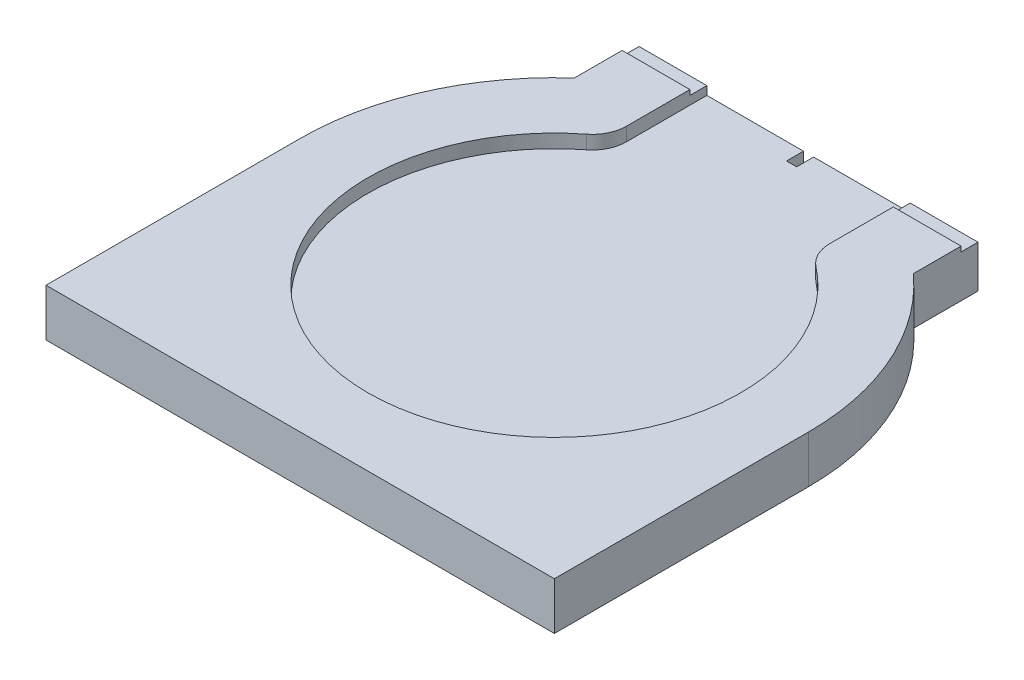
from build123d import *

# Parameters (mm, degrees)
BOSS_EXTRUDE1_DEPTH = 0.8
BOSS_EXTRUDE2_DEPTH = 1
BOSS_EXTRUDE3_START = 1
BOSS_EXTRUDE3_DEPTH = 1
CUT_EXTRUDE1_DEPTH  = 0.5
SKETCH5_W           = 22.271873455
SKETCH5_H           = 20.1975323
CUT_EXTRUDE2_DEPTH  = 3


with BuildPart() as part:
    # Sketch1 → Boss-Extrude1 (new body)
    with BuildSketch(Plane(origin=(0, 0, 0), x_dir=(1, 0, 0), z_dir=(0, 1, 0))):
        with BuildLine():
            Line((-5, 7.5), (-5, 5.590169944))
            ThreePointArc((-5, 5.590169944), (-6.846531969, 3.061862178), (-7.5, 0))
            Line((-7.5, 0), (-7.5, -7.5))
            Line((-7.5, -7.5), (7.5, -7.5))
            Line((7.5, -7.5), (7.5, 0))
            ThreePointArc((7.5, 0), (6.846531969, 3.061862178), (5, 5.590169944))
            Line((5, 5.590169944), (5, 7.5))
            Line((5, 7.5), (3, 7.5))
            Line((3, 7.5), (3, 5.5))
            Line((3, 5.5), (3, 5.123475383))
            ThreePointArc((3, 5.123475383), (3.101282966, 4.684946373), (3.384615385, 4.335248401))
            ThreePointArc((3.384615385, 4.335248401), (0, -5.5), (-3.384615385, 4.335248401))
            ThreePointArc((-3.384615385, 4.335248401), (-3.101282966, 4.684946373), (-3, 5.123475383))
            Line((-3, 5.123475383), (-3, 5.5))
            Line((-3, 5.5), (-3, 7.5))
            Line((-3, 7.5), (-5, 7.5))
        make_face()
    extrude(amount=BOSS_EXTRUDE1_DEPTH)

    # Sketch2 → Boss-Extrude2 (add)
    with BuildSketch(Plane(origin=(0, 0.8, 0), x_dir=(1, 0, 0), z_dir=(0, 1, 0))):
        with BuildLine():
            Line((5, 5.590169944), (5, 7.5))
            Line((5, 7.5), (3, 7.5))
            Line((3, 7.5), (-3, 7.5))
            Line((-3, 7.5), (-5, 7.5))
            Line((-5, 7.5), (-5, 5.590169944))
            ThreePointArc((-5, 5.590169944), (-6.846531969, 3.061862178), (-7.5, 0))
            Line((-7.5, 0), (-7.5, -7.5))
            Line((-7.5, -7.5), (7.5, -7.5))
            Line((7.5, -7.5), (7.5, 0))
            ThreePointArc((7.5, 0), (6.846531969, 3.061862178), (5, 5.590169944))
        make_face()
    extrude(amount=BOSS_EXTRUDE2_DEPTH)

    # Sketch3 → Boss-Extrude3 (add)
    with BuildSketch(Plane.XZ.offset(BOSS_EXTRUDE3_START)):
        with BuildLine():
            Line((-3, -7.5), (-5, -7.5))
            Line((-5, -7.5), (-5, -5.590169944))
            ThreePointArc((-5, -5.590169944), (-6.846531969, -3.061862178), (-7.5, 0))
            Line((-7.5, 0), (-7.5, 7.5))
            Line((-7.5, 7.5), (7.5, 7.5))
            Line((7.5, 7.5), (7.5, 0))
            ThreePointArc((7.5, 0), (6.846531969, -3.061862178), (5, -5.590169944))
            Line((5, -5.590169944), (5, -7.5))
            Line((5, -7.5), (3, -7.5))
            Line((3, -7.5), (-3, -7.5))
        make_face()
    extrude(amount=-BOSS_EXTRUDE3_DEPTH)

    # Sketch4 → Cut-Extrude1 (cut)
    with BuildSketch(Plane(origin=(0, 0, -7.5), x_dir=(-1, 0, 0), z_dir=(0, 0, -1))):
        Polygon((-5, 0.55), (-0.15, 0.55), (-0.15, 1.8), (0.15, 1.8), (0.15, 0.55), (5, 0.55), (5, 0.25), (0.15, 0.25), (0.15, -1), (-0.15, -1), (-0.15, 0.25), (-5, 0.25), align=None)
    extrude(amount=-CUT_EXTRUDE1_DEPTH, mode=Mode.SUBTRACT)

    # Sketch5 → Cut-Extrude2 (cut)
    with BuildSketch(Plane(origin=(0, 0.4, 0), x_dir=(-1, 0, 0), z_dir=(0, -1, 0))):
        with Locations((-0.655055102, -0.150116794)):
            Rectangle(SKETCH5_W, SKETCH5_H)
    extrude(amount=-CUT_EXTRUDE2_DEPTH, mode=Mode.SUBTRACT)


solid = part.part
